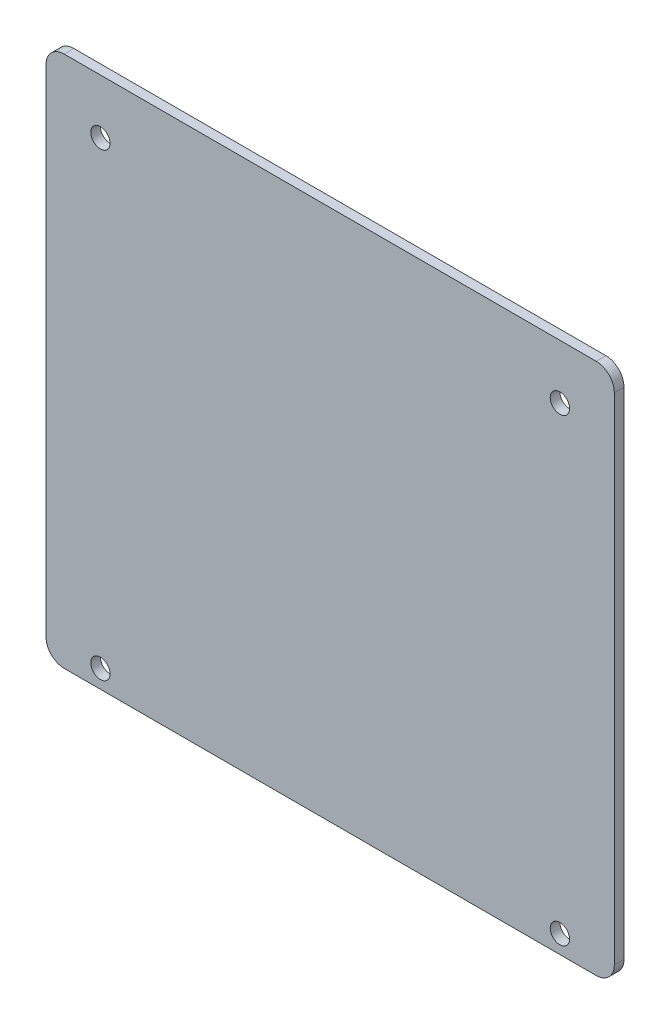
from build123d import *

# Parameters (mm, degrees)
BOSS_EXTRUDE1_DEPTH        = 1.6
F_3_2_3_2_DIAMETER_HOLE3_D = 3.2


with BuildPart() as part:
    # Sketch1 → Boss-Extrude1 (new body)
    with BuildSketch(Plane.XY):
        with BuildLine():
            Line((-87.56534388, 88.95185693), (-87.56534388, 6.95185693))
            ThreePointArc((-87.56534388, 6.95185693), (-86.686664224, 4.830536587), (-84.56534388, 3.95185693))
            Line((-84.56534388, 3.95185693), (3.43465612, 3.95185693))
            ThreePointArc((3.43465612, 3.95185693), (5.555976464, 4.830536587), (6.43465612, 6.95185693))
            Line((6.43465612, 6.95185693), (6.43465612, 88.95185693))
            ThreePointArc((6.43465612, 88.95185693), (5.555976464, 91.073177274), (3.43465612, 91.95185693))
            Line((3.43465612, 91.95185693), (-84.56534388, 91.95185693))
            ThreePointArc((-84.56534388, 91.95185693), (-86.686664224, 91.073177274), (-87.56534388, 88.95185693))
        make_face()
    extrude(amount=BOSS_EXTRUDE1_DEPTH)

    # Ø3.2 (3.2) Diameter Hole3 (through all)
    with Locations(Plane(origin=(0, 0, 0), x_dir=(-1, 0, 0), z_dir=(0, 0, -1))):
        with Locations((78.56534388, 6.95185693), (78.56534388, 82.95185693), (2.56534388, 82.95185693), (2.56534388, 6.95185693)):
            Hole(F_3_2_3_2_DIAMETER_HOLE3_D / 2)


solid = part.part
